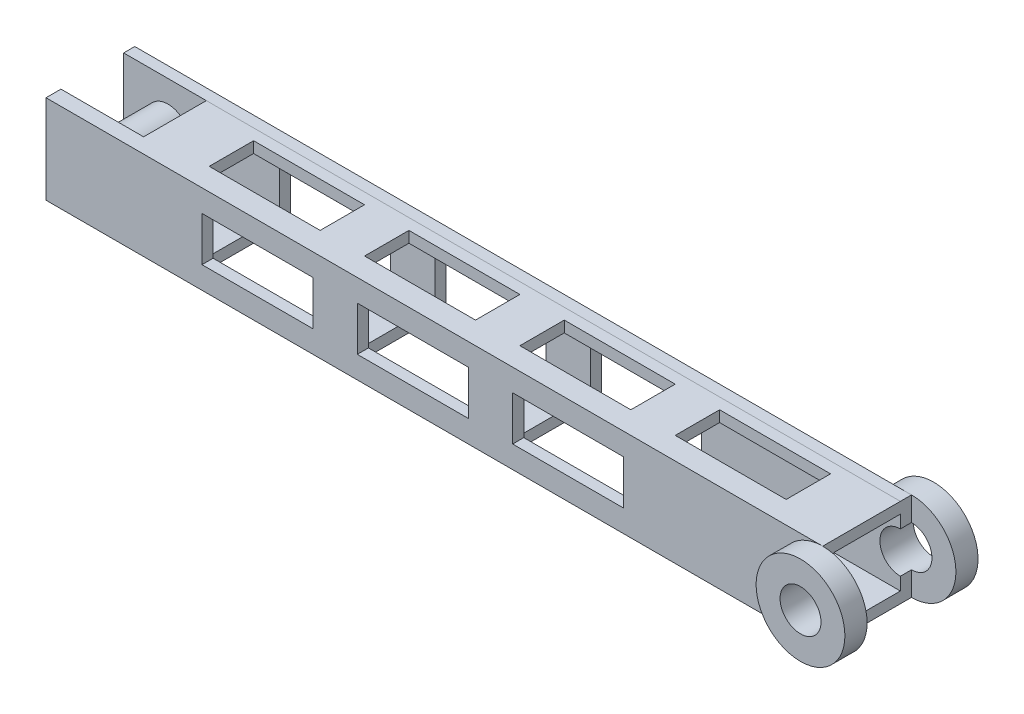
from build123d import *

# Parameters (mm, degrees)
SKETCH1_W               = 350
SKETCH1_H               = 40
BOSS_EXTRUDE1_DEPTH     = 5
SKETCH2_W               = 350
SKETCH2_H               = 5
BOSS_EXTRUDE2_DEPTH     = 30
SKETCH3_W               = 350
SKETCH3_H               = 5
BOSS_EXTRUDE3_DEPTH     = 30
SKETCH5_W               = 350
SKETCH5_H               = 40.001168566
BOSS_EXTRUDE4_DEPTH     = 5
CUT_EXTRUDE1_DEPTH      = 246.966328414
CUT_EXTRUDE1_DEPTH_BACK = 246.966328414
SKETCH7_W               = 50
SKETCH7_H               = 20
CUT_EXTRUDE2_DEPTH      = 248.435367346
CUT_EXTRUDE2_DEPTH_BACK = 248.435367346
SKETCH8_W               = 50
SKETCH8_H               = 20
SKETCH9_R               = 20
BOSS_EXTRUDE5_DEPTH     = 10
BOSS_EXTRUDE6_START     = 10
SKETCH10_R              = 20
BOSS_EXTRUDE6_DEPTH     = 10
SKETCH11_W              = 37.254002163
SKETCH11_H              = 28.263435051
CUT_EXTRUDE3_DEPTH      = 269.625284498
CUT_EXTRUDE4_DEPTH      = 270.32270081
CUT_EXTRUDE4_DEPTH_BACK = 270.32270081
SKETCH12_R              = 9.224826447
SKETCH13_R              = 10
BOSS_EXTRUDE7_DEPTH     = 40


with BuildPart() as part:
    # Sketch1 → Boss-Extrude1 (new body)
    with BuildSketch(Plane.XY):
        with Locations((65.882061447, 9.583746283)):
            Rectangle(SKETCH1_W, SKETCH1_H)
    extrude(amount=BOSS_EXTRUDE1_DEPTH)

    # Sketch2 → Boss-Extrude2 (add)
    with BuildSketch(Plane.XY.offset(5)):
        with Locations((65.882061447, 27.084914849)):
            Rectangle(SKETCH2_W, SKETCH2_H)
    extrude(amount=BOSS_EXTRUDE2_DEPTH)

    # Sketch3 → Boss-Extrude3 (add)
    with BuildSketch(Plane.XY.offset(5)):
        with Locations((65.882061447, -7.916253717)):
            Rectangle(SKETCH3_W, SKETCH3_H)
    extrude(amount=BOSS_EXTRUDE3_DEPTH)

    # Sketch5 → Boss-Extrude4 (add)
    with BuildSketch(Plane.XY.offset(35)):
        with Locations((65.882061447, 9.584330566)):
            Rectangle(SKETCH5_W, SKETCH5_H)
    extrude(amount=BOSS_EXTRUDE4_DEPTH)

    # Sketch7 → Cut-Extrude1 (cut, two sides: drawn at the far end of the back side and taken through both)
    with BuildSketch(Plane.XY.offset(40).offset(-CUT_EXTRUDE1_DEPTH_BACK)):
        with Locations((-13.828244269, 9.583746283)):
            Rectangle(SKETCH7_W, SKETCH7_H)
        with Locations((56.171755731, 9.583746283)):
            Rectangle(SKETCH7_W, SKETCH7_H)
        with Locations((126.171755731, 9.583746283)):
            Rectangle(SKETCH7_W, SKETCH7_H)
    extrude(amount=CUT_EXTRUDE1_DEPTH + CUT_EXTRUDE1_DEPTH_BACK, mode=Mode.SUBTRACT)

    # Sketch8 → Cut-Extrude2 (cut, two sides: drawn at the far end of the back side and taken through both)
    with BuildSketch(Plane(origin=(0, 29.584914849, 0), x_dir=(1, 0, 0), z_dir=(0, 1, 0)).offset(-CUT_EXTRUDE2_DEPTH_BACK)):
        with Locations((-20.575444154, -20)):
            Rectangle(SKETCH8_W, SKETCH8_H)
        with Locations((49.424555846, -20)):
            Rectangle(SKETCH8_W, SKETCH8_H)
        with Locations((119.424555846, -20)):
            Rectangle(SKETCH8_W, SKETCH8_H)
        with Locations((189.424555846, -20)):
            Rectangle(SKETCH8_W, SKETCH8_H)
    extrude(amount=CUT_EXTRUDE2_DEPTH + CUT_EXTRUDE2_DEPTH_BACK, mode=Mode.SUBTRACT)

    # Sketch9 → Boss-Extrude5 (add)
    with BuildSketch(Plane.XY.offset(40)):
        with Locations(Location((240.882061447, 9.584330566, 0), (0, 0, 270))):
            Circle(SKETCH9_R)
    extrude(amount=BOSS_EXTRUDE5_DEPTH)

    # Sketch10 → Boss-Extrude6 (add)
    with BuildSketch(Plane(origin=(0, 0, 0), x_dir=(-1, 0, 0), z_dir=(0, 0, -1)).offset(BOSS_EXTRUDE6_START)):
        with Locations(Location((-240.882061447, 9.584330566, 0), (0, 0, 270))):
            Circle(SKETCH10_R)
    extrude(amount=-BOSS_EXTRUDE6_DEPTH)

    # Sketch11 → Cut-Extrude3 (cut, through all)
    with BuildSketch(Plane(origin=(0, 29.584914849, 0), x_dir=(1, 0, 0), z_dir=(0, 1, 0))):
        with Locations((-90.490937472, -19.131717526)):
            Rectangle(SKETCH11_W, SKETCH11_H)
    extrude(amount=-CUT_EXTRUDE3_DEPTH, mode=Mode.SUBTRACT)

    # Sketch12 → Cut-Extrude4 (cut, two sides: drawn at the far end of the back side and taken through both)
    with BuildSketch(Plane.XY.offset(50).offset(-CUT_EXTRUDE4_DEPTH_BACK)):
        with Locations((240.882061447, 9.584330566)):
            Circle(SKETCH12_R)
    extrude(amount=CUT_EXTRUDE4_DEPTH + CUT_EXTRUDE4_DEPTH_BACK, mode=Mode.SUBTRACT)

    # Sketch13 → Boss-Extrude7 (add)
    with BuildSketch(Plane.XY.offset(40)):
        with Locations((-89.117938553, 9.583746283)):
            Circle(SKETCH13_R)
    extrude(amount=-BOSS_EXTRUDE7_DEPTH)


solid = part.part
